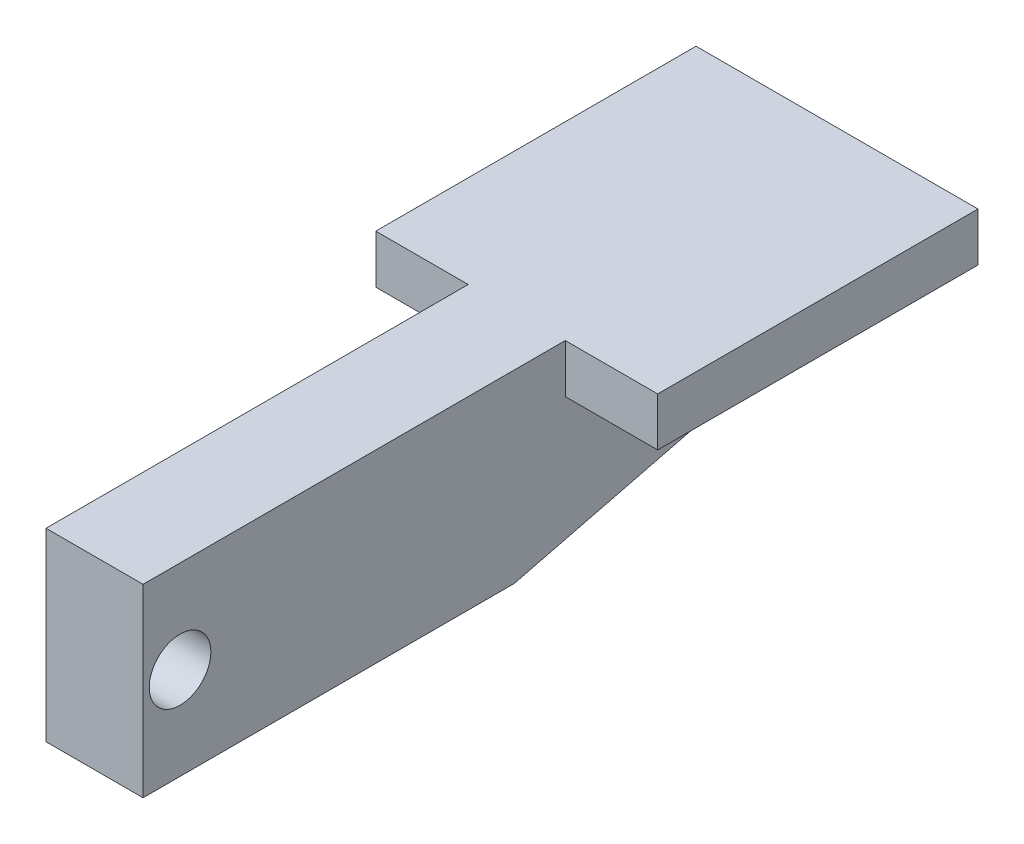
from build123d import *

# Parameters (mm, degrees)
BOSS_EXTRUDE1_DEPTH = 20
SKETCH3_W           = 66
SKETCH3_H           = 10
BOSS_EXTRUDE2_DEPTH = 19.05
SKETCH4_W           = 66
SKETCH4_H           = 10
BOSS_EXTRUDE3_DEPTH = 19.05
SKETCH5_R           = 6.35
CUT_EXTRUDE2_DEPTH  = 88.977582372


with BuildPart() as part:
    # Sketch1 → Boss-Extrude1 (new body)
    with BuildSketch(Plane(origin=(0, 0, 0), x_dir=(0, 0, -1), z_dir=(1, 0, 0))):
        Polygon((0, -19.05), (76.5, 0), (76.5, 19.05), (-76.5, 19.05), (-76.5, -19.05), align=None)
    extrude(amount=BOSS_EXTRUDE1_DEPTH)

    # Sketch3 → Boss-Extrude2 (add)
    with BuildSketch(Plane(origin=(20, 0, 0), x_dir=(0, 0, -1), z_dir=(1, 0, 0))):
        with Locations((43.5, 14.05)):
            Rectangle(SKETCH3_W, SKETCH3_H)
    extrude(amount=BOSS_EXTRUDE2_DEPTH)

    # Sketch4 → Boss-Extrude3 (add)
    with BuildSketch(Plane.ZY):
        with Locations((-43.5, 14.05)):
            Rectangle(SKETCH4_W, SKETCH4_H)
    extrude(amount=BOSS_EXTRUDE3_DEPTH)

    # Sketch5 → Cut-Extrude2 (cut, through all)
    with BuildSketch(Plane(origin=(20, 0, 0), x_dir=(0, 0, -1), z_dir=(1, 0, 0))):
        with Locations((-68.88, 0)):
            Circle(SKETCH5_R)
    extrude(amount=-CUT_EXTRUDE2_DEPTH, mode=Mode.SUBTRACT)


solid = part.part
